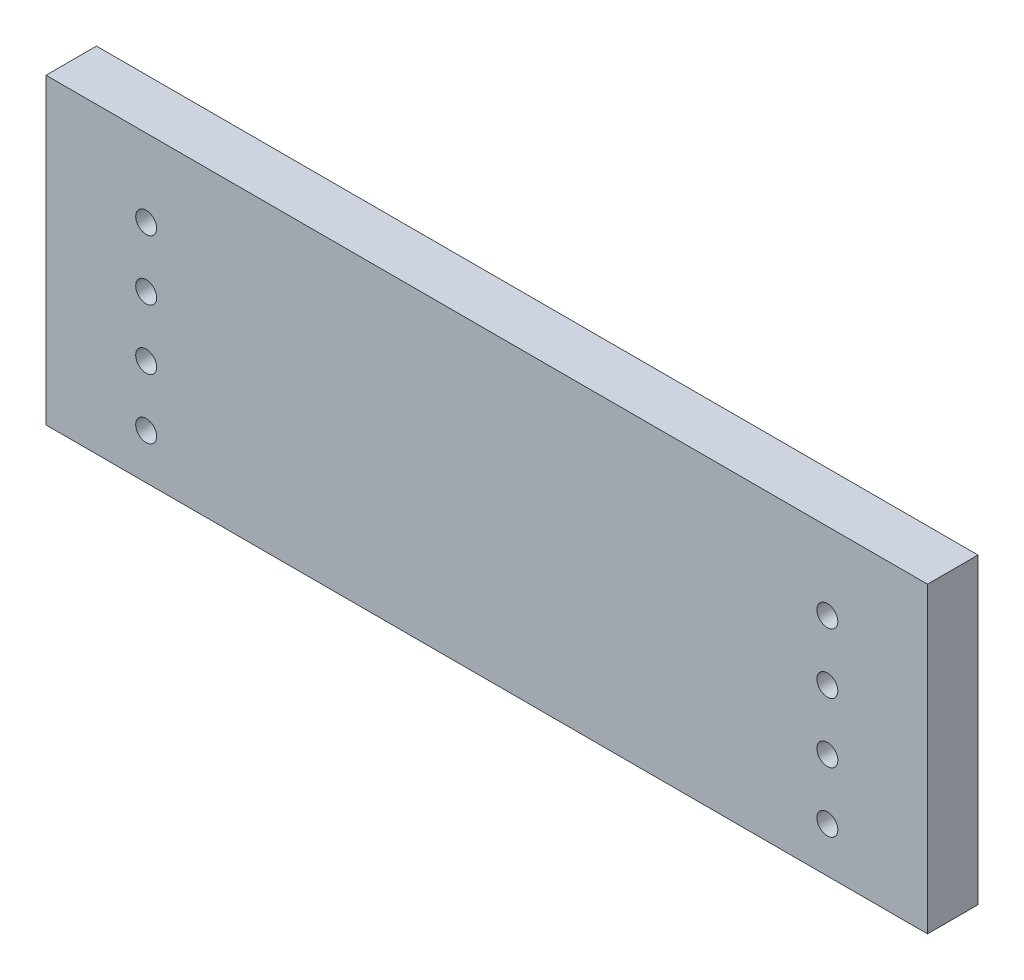
from build123d import *

# Parameters (mm, degrees)
SKETCH1_W                                       = 12
SKETCH1_H                                       = 72
BOSS_EXTRUDE1_DEPTH                             = 104.775
CBORE_FOR_10_BUTTON_HEAD_CAP_SCREW1_D           = 4.9784
CBORE_FOR_10_BUTTON_HEAD_CAP_SCREW1_CBORE_D     = 9.92124
CBORE_FOR_10_BUTTON_HEAD_CAP_SCREW1_CBORE_DEPTH = 2.5654
SKETCH5_R                                       = 5.25
CUT_EXTRUDE1_DEPTH                              = 3.5


with BuildPart() as part:
    # Sketch1 → Boss-Extrude1 (new, symmetric)
    with BuildSketch(Plane(origin=(0, 0, 0), x_dir=(0, 0, -1), z_dir=(1, 0, 0))):
        Rectangle(SKETCH1_W, SKETCH1_H)
    extrude(amount=BOSS_EXTRUDE1_DEPTH, both=True)

    # CBORE for #10 Button Head Cap Screw1 (through all)
    with Locations(Plane(origin=(0, 0, -6), x_dir=(1, 0, 0), z_dir=(0, 0, -1))):
        with Locations((-80.9625, 25.2375), (-80.9625, 10.95), (-80.9625, -3.3375), (-80.9625, -17.625), (80.9625, 25.2375), (80.9625, 10.95), (80.9625, -3.3375), (80.9625, -17.625)):
            CounterBoreHole(CBORE_FOR_10_BUTTON_HEAD_CAP_SCREW1_D / 2, CBORE_FOR_10_BUTTON_HEAD_CAP_SCREW1_CBORE_D / 2, CBORE_FOR_10_BUTTON_HEAD_CAP_SCREW1_CBORE_DEPTH)

    # Sketch5 → Cut-Extrude1 (cut)
    with BuildSketch(Plane(origin=(0, 0, -6), x_dir=(-1, 0, 0), z_dir=(0, 0, -1))):
        with Locations((64.15, 10)):
            Circle(SKETCH5_R)
        with Locations((50.15, 10)):
            Circle(SKETCH5_R)
    extrude(amount=-CUT_EXTRUDE1_DEPTH, mode=Mode.SUBTRACT)


solid = part.part
